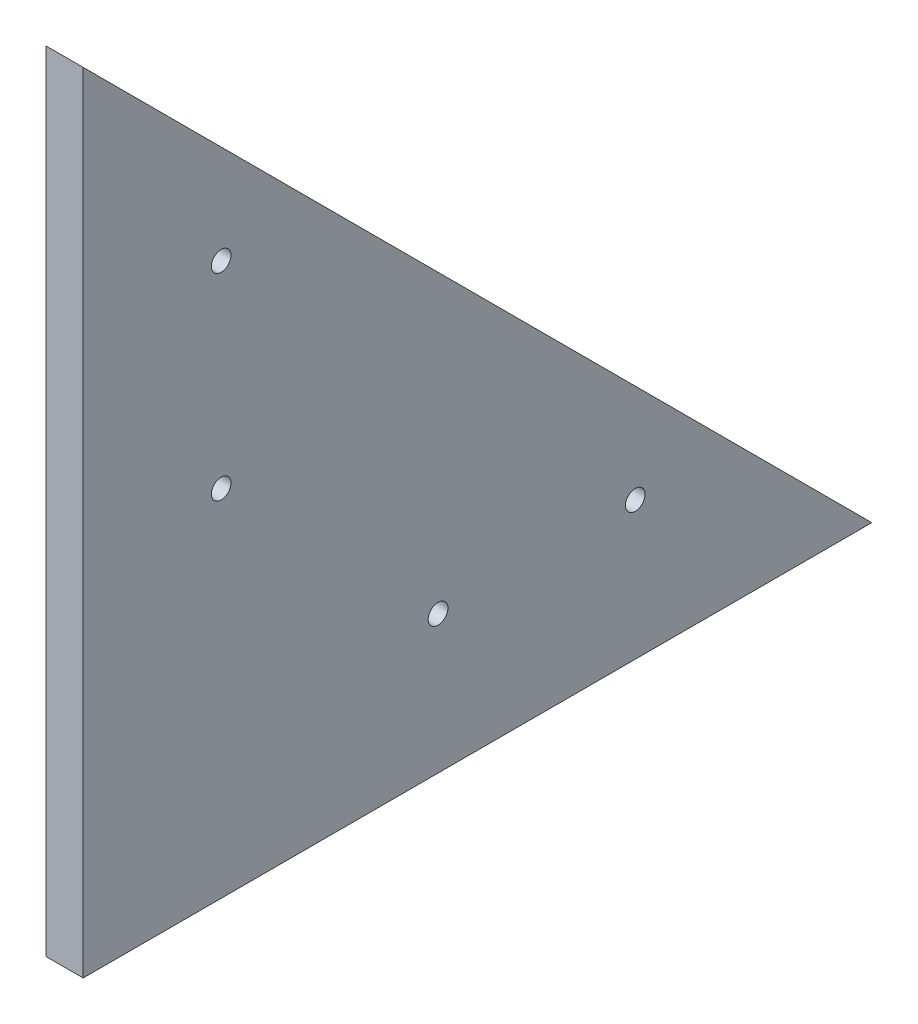
from build123d import *

# Parameters (mm, degrees)
BOSS_EXTRUDE1_DEPTH         = 11.90625
F_1_4_0_25_DIAMETER_HOLE1_D = 6.35


with BuildPart() as part:
    # Sketch1 → Boss-Extrude1 (new body)
    with BuildSketch(Plane(origin=(0, 0, 0), x_dir=(0, 0, -1), z_dir=(1, 0, 0))):
        Polygon((0, 0), (0, 254), (254, 0), align=None)
    extrude(amount=BOSS_EXTRUDE1_DEPTH)

    # 1/4 (0.25) Diameter Hole1 (through all)
    with Locations(Plane.ZY):
        with Locations((-114.3, 44.45), (-44.45, 114.3), (-44.45, 177.8), (-177.8, 44.45)):
            Hole(F_1_4_0_25_DIAMETER_HOLE1_D / 2)


solid = part.part
